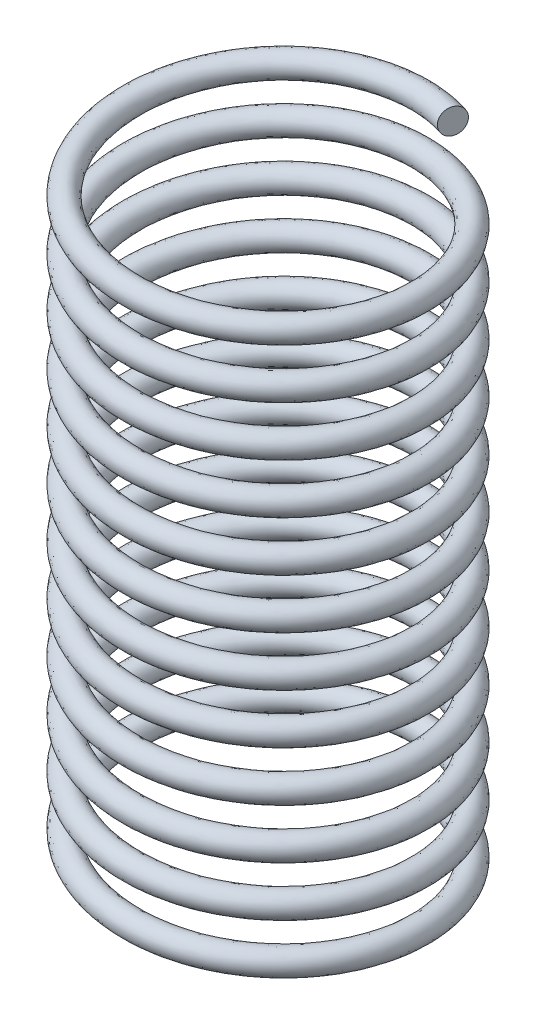
from build123d import *

# Parameters (mm, degrees)
SWEEP1_PITCH       = 4.316666667
SWEEP1_HEIGHT      = 51.8
SWEEP1_RADIUS      = 12.5
SWEEP1_START_ANGLE = 160
SWEEP1_PROFILE_R   = 1.05


with BuildPart() as part:
    # Sweep1: sweep along a helix
    with BuildLine() as sweep1_path:
        add(Helix(SWEEP1_PITCH, SWEEP1_HEIGHT, SWEEP1_RADIUS, center=(0, 0, 0), direction=(0, 1, 0), lefthand=True, mode=Mode.PRIVATE).rotate(Axis((0, 0, 0), (0, 1, 0)), SWEEP1_START_ANGLE))
    # Sweep1 profile (on start of the path) → Sweep1 (sweep)
    with BuildSketch(Plane(origin=(4.275251792, 0, -11.74615776), x_dir=(-0.34202014332592784, 0, 0.9396926207858142), z_dir=(0.938276531887123, 0.054878681654165866, 0.341504729117729))):
        Circle(SWEEP1_PROFILE_R)
    sweep(path=sweep1_path.line, is_frenet=True)


solid = part.part
